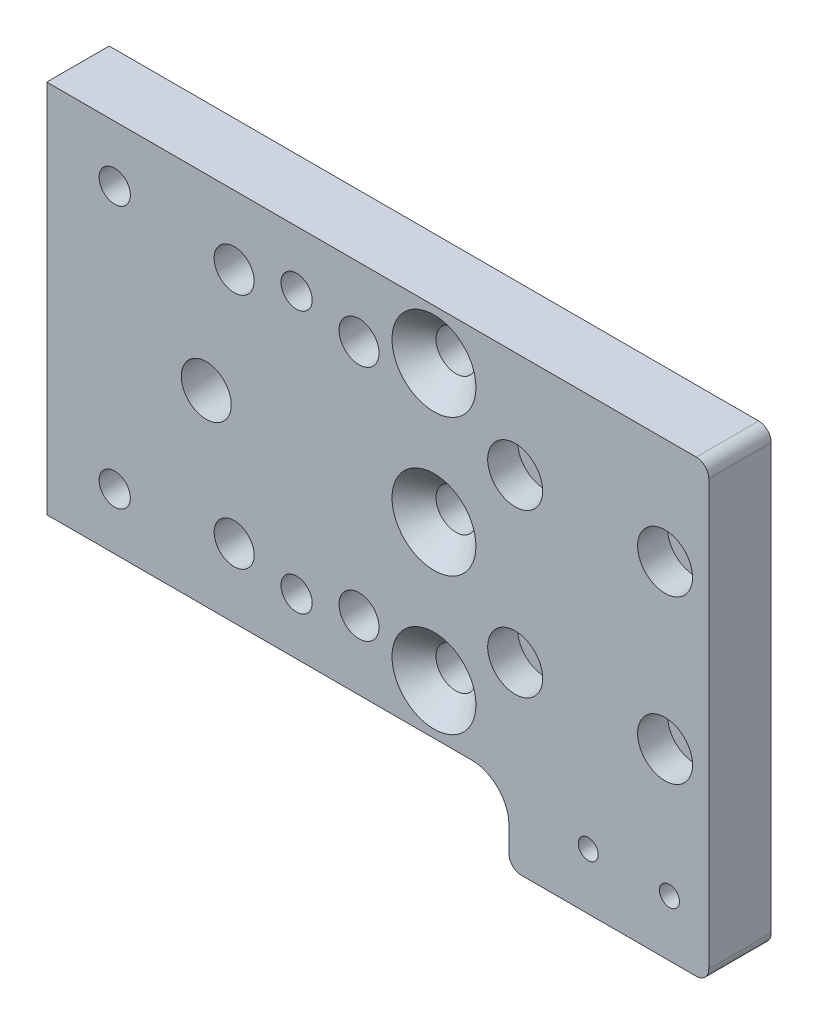
from build123d import *

# Parameters (mm, degrees)
SCHIZZO1_W                                           = 52
SCHIZZO1_H                                           = 30
ESTRUSIONE_ESTRUSIONE1_DEPTH                         = 5
FORO_LAMATO_PER_VITE_M2_A_TESTA_CILINDRI_D           = 2.2
FORO_LAMATO_PER_VITE_M2_A_TESTA_CILINDRI_DEPTH       = 8.5
FORO_LAMATO_PER_VITE_M2_A_TESTA_CILINDRI_CBORE_D     = 4.4
FORO_LAMATO_PER_VITE_M2_A_TESTA_CILINDRI_CBORE_DEPTH = 2.4
FORO_LAMATO_PER_VITE_M2_A_TESTA_CILINDRI_TIP         = 0.660946681
FORO_SVASATO_PER_VITE_M3_1_D                         = 3.2
FORO_SVASATO_PER_VITE_M3_1_DEPTH                     = 8.5
FORO_SVASATO_PER_VITE_M3_1_CSINK_D                   = 6.72
FORO_SVASATO_PER_VITE_M3_1_CSINK_ANGLE               = 90
FORO_SVASATO_PER_VITE_M3_1_TIP                       = 0.96137699
FORO_4_0_4_1_D                                       = 4
FORO_4_0_4_1_DEPTH                                   = 8.5
FORO_4_0_4_1_TIP                                     = 1.201721238
FORO_FILETTATO_M3_1_D                                = 2.5
FORO_FILETTATO_M3_1_DEPTH                            = 8.5
FORO_FILETTATO_M3_1_TIP                              = 0.751075774
FORO_SVASATO_PER_VITE_M3_2_D                         = 3.2
FORO_SVASATO_PER_VITE_M3_2_CSINK_D                   = 6.72
FORO_SVASATO_PER_VITE_M3_2_CSINK_ANGLE               = 90
SCHIZZO11_W                                          = 15
SCHIZZO11_H                                          = 5
ESTRUSIONE_ESTRUSIONE2_DEPTH                         = 6
FORO_FILETTATO_M2_1_D                                = 1.6
FORO_FILETTATO_M2_1_DEPTH                            = 6
FORO_FILETTATO_M2_1_TIP                              = 0.480688495
SCHIZZO14_W                                          = 1
SCHIZZO14_H                                          = 5
ESTRUSIONE_ESTRUSIONE3_DEPTH                         = 36
RACCORDO1_R                                          = 1
RACCORDO2_R                                          = 3


with BuildPart() as part:
    # Schizzo1 → Estrusione-Estrusione1 (new body)
    with BuildSketch(Plane.XY):
        Rectangle(SCHIZZO1_W, SCHIZZO1_H)
    extrude(amount=ESTRUSIONE_ESTRUSIONE1_DEPTH)

    # Foro lamato per Vite M2 a testa cilindrica-1
    with Locations(Plane(origin=(11.5, 6.5, 5), x_dir=(1, 0, 0), z_dir=(0, 0, 1))):
        with Locations((0, 0), (12, 0), (0, -13), (12, -13)):
            CounterBoreHole(FORO_LAMATO_PER_VITE_M2_A_TESTA_CILINDRI_D / 2, FORO_LAMATO_PER_VITE_M2_A_TESTA_CILINDRI_CBORE_D / 2, FORO_LAMATO_PER_VITE_M2_A_TESTA_CILINDRI_CBORE_DEPTH, depth=FORO_LAMATO_PER_VITE_M2_A_TESTA_CILINDRI_DEPTH)
            with Locations((0, 0, -(FORO_LAMATO_PER_VITE_M2_A_TESTA_CILINDRI_DEPTH + FORO_LAMATO_PER_VITE_M2_A_TESTA_CILINDRI_TIP / 2))):  # 118° drill point
                Cone(0, FORO_LAMATO_PER_VITE_M2_A_TESTA_CILINDRI_D / 2, FORO_LAMATO_PER_VITE_M2_A_TESTA_CILINDRI_TIP, mode=Mode.SUBTRACT)

    # Foro svasato per Vite M3-1
    with Locations(Plane(origin=(0, 0, 0), x_dir=(-1, 0, 0), z_dir=(0, 0, -1))):
        with Locations((11, -9.5), (1, -9.5), (11, 9.5), (1, 9.5)):
            CounterSinkHole(FORO_SVASATO_PER_VITE_M3_1_D / 2, FORO_SVASATO_PER_VITE_M3_1_CSINK_D / 2, depth=FORO_SVASATO_PER_VITE_M3_1_DEPTH, counter_sink_angle=FORO_SVASATO_PER_VITE_M3_1_CSINK_ANGLE)
            with Locations((0, 0, -(FORO_SVASATO_PER_VITE_M3_1_DEPTH + FORO_SVASATO_PER_VITE_M3_1_TIP / 2))):  # 118° drill point
                Cone(0, FORO_SVASATO_PER_VITE_M3_1_D / 2, FORO_SVASATO_PER_VITE_M3_1_TIP, mode=Mode.SUBTRACT)

    # Foro Ø4.0 (4)-1
    with Locations(Plane(origin=(-13.23, 0, 5), x_dir=(1, 0, 0), z_dir=(0, 0, 1))):
        with Locations((0, 0)):
            Hole(FORO_4_0_4_1_D / 2, depth=FORO_4_0_4_1_DEPTH)
            with Locations((0, 0, -(FORO_4_0_4_1_DEPTH + FORO_4_0_4_1_TIP / 2))):  # 118° drill point
                Cone(0, FORO_4_0_4_1_D / 2, FORO_4_0_4_1_TIP, mode=Mode.SUBTRACT)

    # Foro filettato M3-1
    with Locations(Plane(origin=(-20.56, 10.5, 5), x_dir=(1, 0, 0), z_dir=(0, 0, 1))):
        with Locations((0, 0), (14.56, 0), (14.56, -21), (0, -21)):
            Hole(FORO_FILETTATO_M3_1_D / 2, depth=FORO_FILETTATO_M3_1_DEPTH)
            with Locations((0, 0, -(FORO_FILETTATO_M3_1_DEPTH + FORO_FILETTATO_M3_1_TIP / 2))):  # 118° drill point
                Cone(0, FORO_FILETTATO_M3_1_D / 2, FORO_FILETTATO_M3_1_TIP, mode=Mode.SUBTRACT)

    # Foro svasato per Vite M3-2 (through all)
    with Locations(Plane(origin=(5, 11, 5), x_dir=(1, 0, 0), z_dir=(0, 0, 1))):
        with Locations((0, 0), (0, -11), (0, -22)):
            CounterSinkHole(FORO_SVASATO_PER_VITE_M3_2_D / 2, FORO_SVASATO_PER_VITE_M3_2_CSINK_D / 2, counter_sink_angle=FORO_SVASATO_PER_VITE_M3_2_CSINK_ANGLE)

    # Schizzo11 → Estrusione-Estrusione2 (add)
    with BuildSketch(Plane.XZ.offset(15)):
        with Locations((18.5, 2.5)):
            Rectangle(SCHIZZO11_W, SCHIZZO11_H)
    extrude(amount=ESTRUSIONE_ESTRUSIONE2_DEPTH)

    # Foro filettato M2-1
    with Locations(Plane(origin=(17.35, -16.5, 5), x_dir=(1, 0, 0), z_dir=(0, 0, 1))):
        with Locations((0, 0), (6.5, 0)):
            Hole(FORO_FILETTATO_M2_1_D / 2, depth=FORO_FILETTATO_M2_1_DEPTH)
            with Locations((0, 0, -(FORO_FILETTATO_M2_1_DEPTH + FORO_FILETTATO_M2_1_TIP / 2))):  # 118° drill point
                Cone(0, FORO_FILETTATO_M2_1_D / 2, FORO_FILETTATO_M2_1_TIP, mode=Mode.SUBTRACT)

    # Schizzo14 → Estrusione-Estrusione3 (add)
    with BuildSketch(Plane.XZ.offset(21)):
        with Locations((26.5, 2.5)):
            Rectangle(SCHIZZO14_W, SCHIZZO14_H)
    extrude(amount=-ESTRUSIONE_ESTRUSIONE3_DEPTH)

    # Raccordo1
    raccordo1_edges = [part.edges().sort_by_distance(p)[0] for p in [
        (11, -21, 2.5),
        (27, -21, 2.5),
        (27, 15, 2.5),
    ]]
    fillet(raccordo1_edges, radius=RACCORDO1_R)

    # Raccordo2
    raccordo2_edges = [part.edges().sort_by_distance(p)[0] for p in [
        (11, -15, 2.5),
    ]]
    fillet(raccordo2_edges, radius=RACCORDO2_R)


solid = part.part
